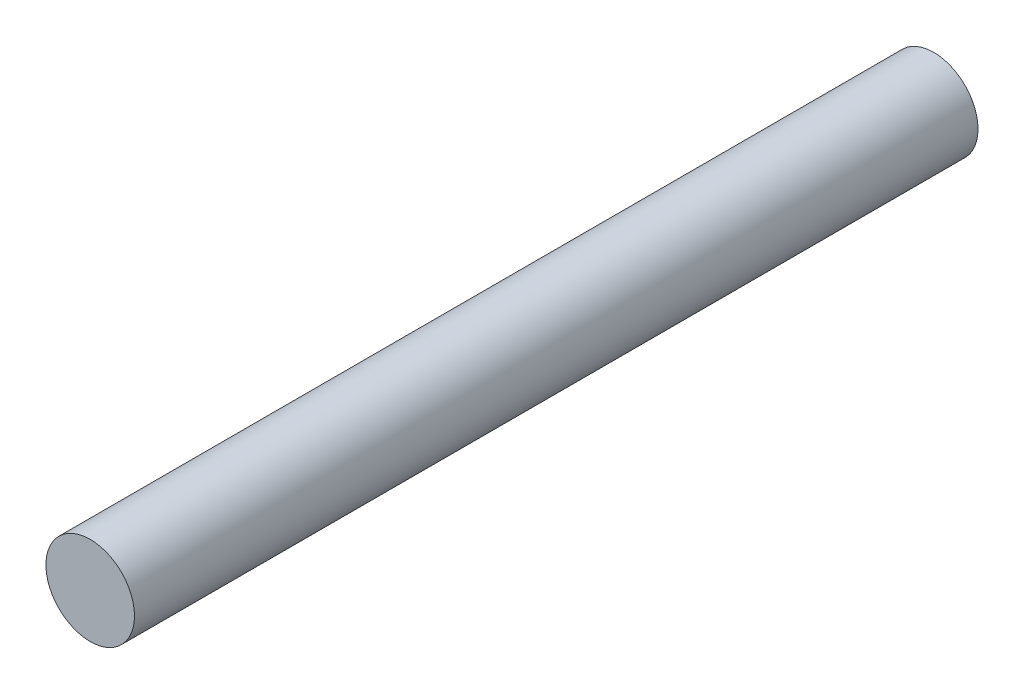
from build123d import *

# Parameters (mm, degrees)
SCHIZZO1_R                   = 2.1
ESTRUSIONE_ESTRUSIONE1_DEPTH = 40


with BuildPart() as part:
    # Schizzo1 → Estrusione-Estrusione1 (new body)
    with BuildSketch(Plane(origin=(0, 0, 0), x_dir=(0, 1, 0), z_dir=(0, 0, 1))):
        with Locations(Location((0, 0, 0), (0, 0, 270))):
            Circle(SCHIZZO1_R)
    extrude(amount=ESTRUSIONE_ESTRUSIONE1_DEPTH)


solid = part.part
